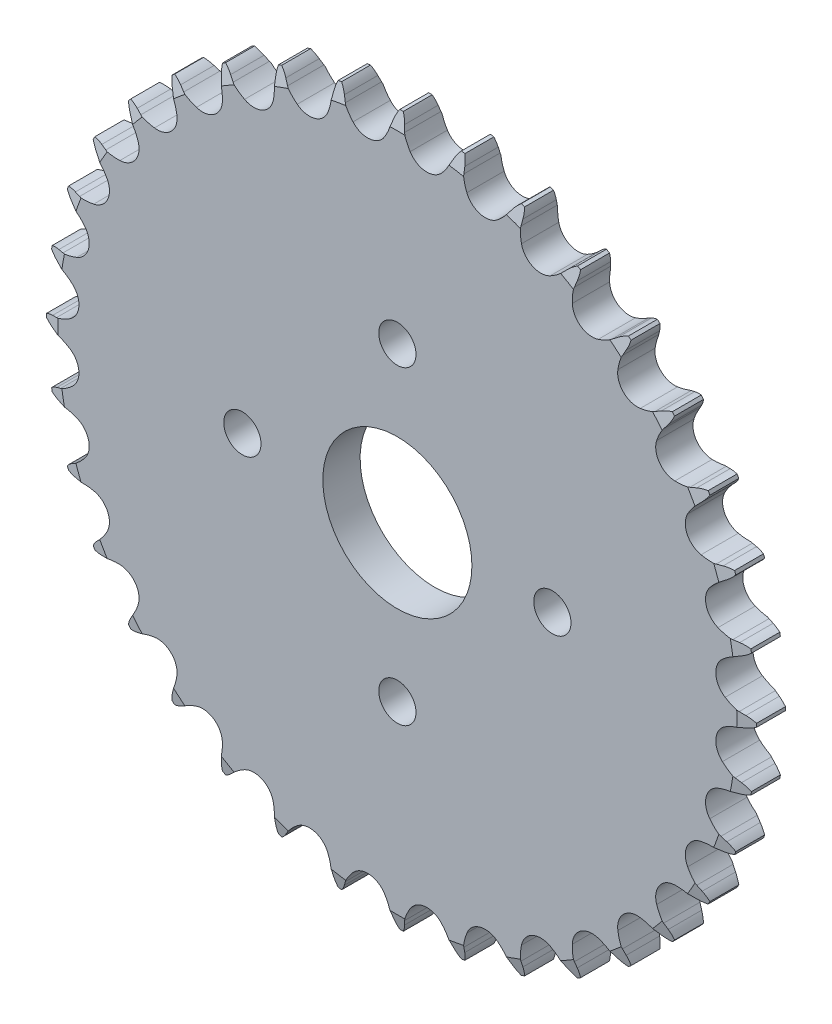
from build123d import *

# Parameters (mm, degrees)
SKETCH3_W          = 6
SKETCH3_H          = 51.15
CUT_EXTRUDE4_DEPTH = 81.877963624
CIRPATTERN2_COUNT  = 36
SKETCH5_OUTSIDE_W  = 761.042
SKETCH5_OUTSIDE_H  = 761.042
SKETCH5_OUTSIDE_R  = 54.643559333
CUT_EXTRUDE5_DEPTH = 82.044709883
CUT_EXTRUDE5_DRAFT = -75
SKETCH6_OUTSIDE_W  = 761.042
SKETCH6_OUTSIDE_H  = 761.042
SKETCH6_OUTSIDE_R  = 54.643559333
CUT_EXTRUDE6_DEPTH = 82.044710031
CUT_EXTRUDE6_DRAFT = -75
SKETCH8_R          = 12
SKETCH8_R_2        = 3
CUT_EXTRUDE7_DEPTH = 63


with BuildPart() as part:
    # Sketch3 → Revolve5 (revolve)
    with BuildSketch(Plane(origin=(0, 0, 0), x_dir=(0, 0, -1), z_dir=(1, 0, 0))):
        with Locations((0, 31.575)):
            Rectangle(SKETCH3_W, SKETCH3_H)
    revolve(axis=Axis((0, 0, 3), (0, 0, -1)))

    # Sketch4 → Cut-Extrude4 (cut, symmetric)
    with BuildSketch(Plane.XY):
        with BuildLine():
            Line((1.104036193, 54.930481871), (0.868749264, 55.795156036))
            ThreePointArc((0.868749264, 55.795156036), (0.519131488, 56.720279346), (0, 57.562056174))
            ThreePointArc((0, 57.562056174), (5.259027604, 60.110960571), (9.995546157, 56.687559199))
            ThreePointArc((9.995546157, 56.687559199), (9.338128432, 55.94871709), (8.833176158, 55.098358971))
            Line((8.833176158, 55.098358971), (8.451314672, 54.287678296))
            ThreePointArc((8.451314672, 54.287678296), (7.864514532, 53.258054152), (7.136611041, 52.322844661))
            ThreePointArc((7.136611041, 52.322844661), (4.485511423, 51.269630174), (2.057576742, 52.767202584))
            ThreePointArc((2.057576742, 52.767202584), (1.503129165, 53.814603256), (1.104036193, 54.930481871))
        make_face()
    cut_extrude4 = extrude(amount=CUT_EXTRUDE4_DEPTH, both=True, mode=Mode.SUBTRACT)

    # CirPattern2: Cut-Extrude4 ×36 about axis
    cirpattern2_axis = Axis((0, 0, 3), (0, 0, -1))
    for i in range(1, CIRPATTERN2_COUNT):
        add(cut_extrude4.rotate(cirpattern2_axis, i * 360 / CIRPATTERN2_COUNT), mode=Mode.SUBTRACT)


with BuildPart() as cut_extrude5_tool:
    # Sketch5 outside → Cut-Extrude5 (with draft: the straight prism first)
    with BuildSketch(Plane.XY.offset(3)):
        Rectangle(SKETCH5_OUTSIDE_W, SKETCH5_OUTSIDE_H)
        Circle(SKETCH5_OUTSIDE_R, mode=Mode.SUBTRACT)
    extrude(amount=-CUT_EXTRUDE5_DEPTH)
    # Cut-Extrude5: the draft: its side faces are tilted about the plane it starts from
    cut_extrude5_sides = [cut_extrude5_tool.faces().sort_by_distance(p)[0] for p in [
        (0, -380.521, -38.022354941),
        (380.521, 0, -38.022354941),
        (0, 380.521, -38.022354941),
        (-380.521, 0, -38.022354941),
        (-54.643559333, 0, -38.022354941),
    ]]
    draft(cut_extrude5_sides, Plane.XY.offset(3), CUT_EXTRUDE5_DRAFT)


with BuildPart() as part_1:
    add(part.part)

    # Cut-Extrude5: cut by cut_extrude5_tool
    add(cut_extrude5_tool.part, mode=Mode.SUBTRACT)


with BuildPart() as cut_extrude6_tool:
    # Sketch6 outside → Cut-Extrude6 (with draft: the straight prism first)
    with BuildSketch(Plane(origin=(0, 0, -3), x_dir=(-1, 0, 0), z_dir=(0, 0, -1))):
        Rectangle(SKETCH6_OUTSIDE_W, SKETCH6_OUTSIDE_H)
        Circle(SKETCH6_OUTSIDE_R, mode=Mode.SUBTRACT)
    extrude(amount=-CUT_EXTRUDE6_DEPTH)
    # Cut-Extrude6: the draft: its side faces are tilted about the plane it starts from
    cut_extrude6_sides = [cut_extrude6_tool.faces().sort_by_distance(p)[0] for p in [
        (0, -380.521, 38.022355016),
        (-380.521, 0, 38.022355016),
        (0, 380.521, 38.022355016),
        (380.521, 0, 38.022355016),
        (54.643559333, 0, 38.022355016),
    ]]
    draft(cut_extrude6_sides, Plane(origin=(0, 0, -3), x_dir=(-1, 0, 0), z_dir=(0, 0, -1)), CUT_EXTRUDE6_DRAFT)


with BuildPart() as part_2:
    add(part_1.part)

    # Cut-Extrude6: cut by cut_extrude6_tool
    add(cut_extrude6_tool.part, mode=Mode.SUBTRACT)

    # Sketch8 → Cut-Extrude7 (cut)
    with BuildSketch(Plane.XY.offset(3)):
        Circle(SKETCH8_R)
        with Locations((0, 24.95)):
            Circle(SKETCH8_R_2)
        with Locations((-24.95, 0)):
            Circle(SKETCH8_R_2)
        with Locations((24.95, 0)):
            Circle(SKETCH8_R_2)
        with Locations((0, -24.95)):
            Circle(SKETCH8_R_2)
    extrude(amount=-CUT_EXTRUDE7_DEPTH, mode=Mode.SUBTRACT)


solid = part_2.part
